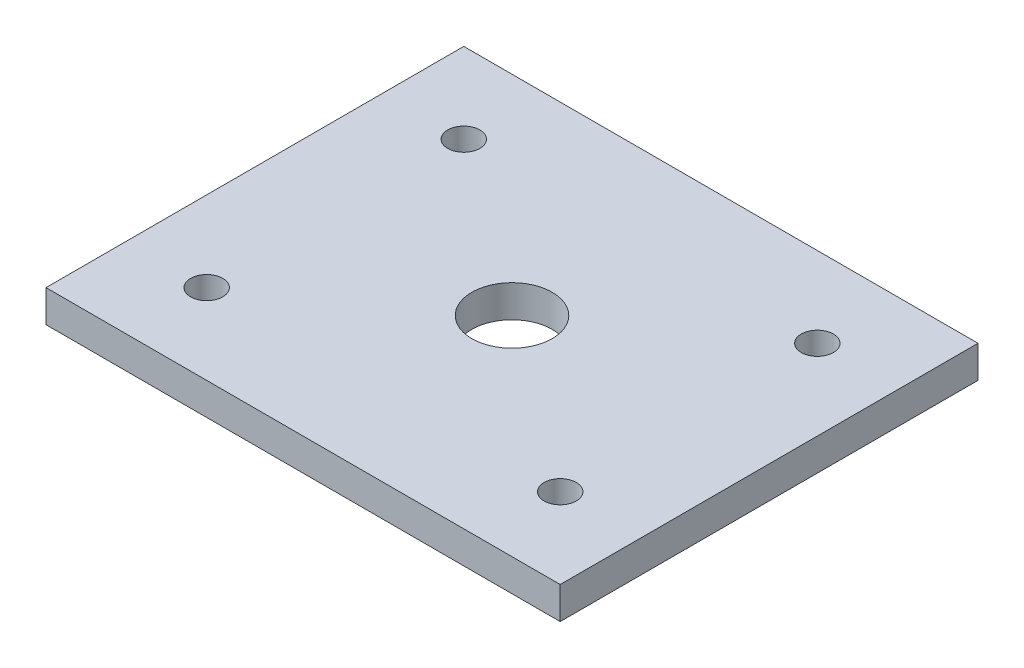
from build123d import *

# Parameters (mm, degrees)
SKETCH1_W           = 64
SKETCH1_H           = 52
SKETCH1_R           = 5
SKETCH1_R_2         = 2
PLATE_EXTRUDE_DEPTH = 4


with BuildPart() as part:
    # Sketch1 → Plate_Extrude (new body)
    with BuildSketch(Plane(origin=(0, 0, 0), x_dir=(1, 0, 0), z_dir=(0, 1, 0))):
        Rectangle(SKETCH1_W, SKETCH1_H)
        with Locations(Location((0, 0, 0), (0, 0, 270))):
            Circle(SKETCH1_R, mode=Mode.SUBTRACT)
        with Locations(Location((-22, -16, 0), (0, 0, 270))):
            Circle(SKETCH1_R_2, mode=Mode.SUBTRACT)
        with Locations(Location((22, -16, 0), (0, 0, 270))):
            Circle(SKETCH1_R_2, mode=Mode.SUBTRACT)
        with Locations(Location((-22, 16, 0), (0, 0, 270))):
            Circle(SKETCH1_R_2, mode=Mode.SUBTRACT)
        with Locations(Location((22, 16, 0), (0, 0, 270))):
            Circle(SKETCH1_R_2, mode=Mode.SUBTRACT)
    extrude(amount=PLATE_EXTRUDE_DEPTH)


solid = part.part
